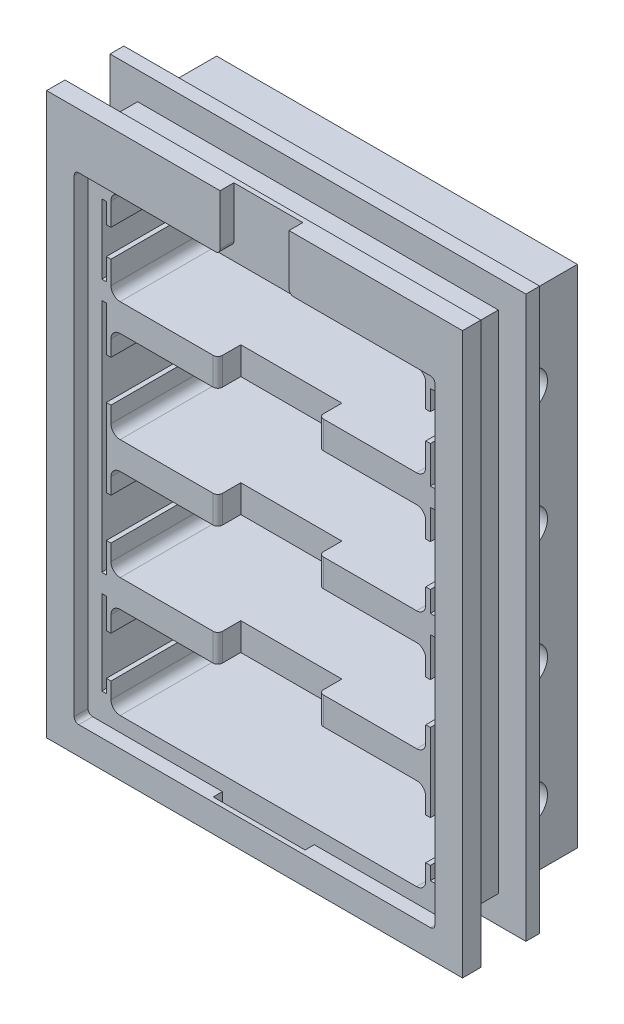
from build123d import *

# Parameters (mm, degrees)
SKETCH1_R                = 1.55
BOSS_EXTRUDE1_DEPTH      = 25
SKETCH2_W                = 78.500001967
SKETCH2_H                = 110
BOSS_EXTRUDE2_DEPTH      = 3
BOSS_EXTRUDE4_DEPTH      = 3
BOSS_EXTRUDE4_DEPTH_BACK = 1
SKETCH4_W                = 90.500001967
SKETCH4_H                = 122
SKETCH4_W_2              = 78.500001967
SKETCH4_H_2              = 110
SKETCH5_W                = 12
SKETCH5_H                = 3
SKETCH5_H_2              = 2
CUT_EXTRUDE1_DEPTH       = 4
SKETCH6_W                = 0.999998301
SKETCH6_H                = 11.230002105
SKETCH6_H_2              = 11.230002106
CUT_EXTRUDE2_DEPTH       = 25
CUT_EXTRUDE3_DEPTH       = 145.507259106
CUT_EXTRUDE3_DEPTH_BACK  = 145.507259106
SKETCH10_R               = 1.5
SKETCH14_R               = 4
CUT_EXTRUDE4_DEPTH       = 1.8
CUT_EXTRUDE5_START       = -1.8
SKETCH15_R               = 4
CUT_EXTRUDE5_DEPTH       = 1.8
SKETCH16_W               = 90.500001967
SKETCH16_H               = 122
SKETCH16_W_2             = 78.500001967
SKETCH16_H_2             = 110
BOSS_EXTRUDE5_DEPTH      = 3
SKETCH3_W                = 88.500001967
SKETCH3_H                = 120
SKETCH3_W_2              = 78.500001967
SKETCH3_H_2              = 104
BOSS_EXTRUDE3_DEPTH      = 3
SKETCH19_W               = 20
SKETCH19_H               = 2
CUT_EXTRUDE7_DEPTH       = 147.219869828
SKETCH20_W               = 22.901962545
SKETCH20_H               = 5.863970951
BOSS_EXTRUDE7_DEPTH      = 1
SKETCH21_W               = 15
SKETCH21_H               = 12
CUT_EXTRUDE8_DEPTH       = 3
FILLET1_R                = 1
SKETCH17_R               = 2
BOSS_EXTRUDE6_DEPTH      = 5
SKETCH18_W               = 116.372418442
SKETCH18_H               = 131.31127259
CUT_EXTRUDE6_DEPTH       = 2
SKETCH22_W               = 19
SKETCH22_H               = 1.8
BOSS_EXTRUDE8_DEPTH      = 4
FILLET2_R                = 0.5
SKETCH23_W               = 128.007557952
SKETCH23_H               = 137.306220181
CUT_EXTRUDE9_DEPTH       = 147.823875212
SKETCH24_R               = 3.048362671
BOSS_EXTRUDE9_DEPTH      = 4
SKETCH25_W               = 0.999998301
SKETCH25_H               = 4
SKETCH25_H_2             = 3.999998585
BOSS_EXTRUDE10_DEPTH     = 25
SKETCH26_W               = 2
SKETCH26_H               = 4
CUT_EXTRUDE10_DEPTH      = 10
SKETCH27_W               = 1.00120379
SKETCH27_H               = 1.5
CUT_EXTRUDE11_DEPTH      = 25
SKETCH28_W               = 22
SKETCH28_H               = 6
CUT_EXTRUDE12_DEPTH      = 5
FILLET3_R                = 1


with BuildPart() as part:
    # Sketch1 → Boss-Extrude1 (new body)
    with BuildSketch(Plane.XY):
        Polygon((39.250000983, 0), (78.500001967, 0), (78.500001967, 110), (0, 110), (0, 0), align=None)
        with Locations((39.250000983, 105.61)):
            Circle(SKETCH1_R, mode=Mode.SUBTRACT)
        with BuildLine():
            Line((2.999401145, 5.835748483), (3.999399446, 5.835748483))
            Line((3.999399446, 5.835748483), (3.999399446, 10.220747148))
            Line((3.999399446, 10.220747148), (5.000603236, 10.220747148))
            Line((5.000603236, 10.220747148), (5.000603236, 5.220747431))
            ThreePointArc((5.000603236, 5.220747431), (5.586389674, 3.806533868), (7.000603236, 3.220747431))
            Line((7.000603236, 3.220747431), (71.500600494, 3.220747431))
            ThreePointArc((71.500600494, 3.220747431), (72.914814057, 3.806533868), (73.500600494, 5.220747431))
            Line((73.500600494, 5.220747431), (73.500600494, 10.220747148))
            Line((73.500600494, 10.220747148), (74.501804284, 10.220747148))
            Line((74.501804284, 10.220747148), (74.501804284, 5.835748483))
            Line((74.501804284, 5.835748483), (75.501802585, 5.835748483))
            Line((75.501802585, 5.835748483), (75.501802585, 20.605747794))
            Line((75.501802585, 20.605747794), (74.501804284, 20.605747794))
            Line((74.501804284, 20.605747794), (74.501804284, 16.220747148))
            Line((74.501804284, 16.220747148), (73.500600494, 16.220747148))
            Line((73.500600494, 16.220747148), (73.500600494, 21.220748846))
            ThreePointArc((73.500600494, 21.220748846), (72.914814057, 22.634962409), (71.500600494, 23.220748846))
            Line((71.500600494, 23.220748846), (7.000603236, 23.220748846))
            ThreePointArc((7.000603236, 23.220748846), (5.586389674, 22.634962409), (5.000603236, 21.220748846))
            Line((5.000603236, 21.220748846), (5.000603236, 16.220747148))
            Line((5.000603236, 16.220747148), (3.999399446, 16.220747148))
            Line((3.999399446, 16.220747148), (3.999399446, 20.605747794))
            Line((3.999399446, 20.605747794), (2.999401145, 20.605747794))
            Line((2.999401145, 20.605747794), (2.999401145, 5.835748483))
        make_face(mode=Mode.SUBTRACT)
        with BuildLine():
            Line((7.000603236, 29.220747431), (71.500600494, 29.220747431))
            ThreePointArc((71.500600494, 29.220747431), (72.914814057, 29.806533868), (73.500600494, 31.220747431))
            Line((73.500600494, 31.220747431), (73.500600494, 36.220747148))
            Line((73.500600494, 36.220747148), (74.501804284, 36.220747148))
            Line((74.501804284, 36.220747148), (74.501804284, 31.835748483))
            Line((74.501804284, 31.835748483), (75.501802585, 31.835748483))
            Line((75.501802585, 31.835748483), (75.501802585, 46.605747794))
            Line((75.501802585, 46.605747794), (74.501804284, 46.605747794))
            Line((74.501804284, 46.605747794), (74.501804284, 42.220747148))
            Line((74.501804284, 42.220747148), (73.500600494, 42.220747148))
            Line((73.500600494, 42.220747148), (73.500600494, 47.220748846))
            ThreePointArc((73.500600494, 47.220748846), (72.914814057, 48.634962409), (71.500600494, 49.220748846))
            Line((71.500600494, 49.220748846), (7.000603236, 49.220748846))
            ThreePointArc((7.000603236, 49.220748846), (5.586389674, 48.634962409), (5.000603236, 47.220748846))
            Line((5.000603236, 47.220748846), (5.000603236, 42.220747148))
            Line((5.000603236, 42.220747148), (3.999399446, 42.220747148))
            Line((3.999399446, 42.220747148), (3.999399446, 46.605747794))
            Line((3.999399446, 46.605747794), (2.999401145, 46.605747794))
            Line((2.999401145, 46.605747794), (2.999401145, 31.835748483))
            Line((2.999401145, 31.835748483), (3.999399446, 31.835748483))
            Line((3.999399446, 31.835748483), (3.999399446, 36.220747148))
            Line((3.999399446, 36.220747148), (5.000603236, 36.220747148))
            Line((5.000603236, 36.220747148), (5.000603236, 31.220747431))
            ThreePointArc((5.000603236, 31.220747431), (5.586389674, 29.806533868), (7.000603236, 29.220747431))
        make_face(mode=Mode.SUBTRACT)
        with BuildLine():
            Line((73.500600494, 57.220748846), (73.500600494, 62.220748563))
            Line((73.500600494, 62.220748563), (74.501804284, 62.220748563))
            Line((74.501804284, 62.220748563), (74.501804284, 57.835749899))
            Line((74.501804284, 57.835749899), (75.501802585, 57.835749899))
            Line((75.501802585, 57.835749899), (75.501802585, 72.605749209))
            Line((75.501802585, 72.605749209), (74.501804284, 72.605749209))
            Line((74.501804284, 72.605749209), (74.501804284, 68.220748563))
            Line((74.501804284, 68.220748563), (73.500600494, 68.220748563))
            Line((73.500600494, 68.220748563), (73.500600494, 73.220750262))
            ThreePointArc((73.500600494, 73.220750262), (72.914814057, 74.634963824), (71.500600494, 75.220750262))
            Line((71.500600494, 75.220750262), (7.000603236, 75.220750262))
            ThreePointArc((7.000603236, 75.220750262), (5.586389674, 74.634963824), (5.000603236, 73.220750262))
            Line((5.000603236, 73.220750262), (5.000603236, 68.220748563))
            Line((5.000603236, 68.220748563), (3.999399446, 68.220748563))
            Line((3.999399446, 68.220748563), (3.999399446, 72.605749209))
            Line((3.999399446, 72.605749209), (2.999401145, 72.605749209))
            Line((2.999401145, 72.605749209), (2.999401145, 57.835749899))
            Line((2.999401145, 57.835749899), (3.999399446, 57.835749899))
            Line((3.999399446, 57.835749899), (3.999399446, 62.220748563))
            Line((3.999399446, 62.220748563), (5.000603236, 62.220748563))
            Line((5.000603236, 62.220748563), (5.000603236, 57.220748846))
            ThreePointArc((5.000603236, 57.220748846), (5.586389674, 55.806535284), (7.000603236, 55.220748846))
            Line((7.000603236, 55.220748846), (71.500600494, 55.220748846))
            ThreePointArc((71.500600494, 55.220748846), (72.914814057, 55.806535284), (73.500600494, 57.220748846))
        make_face(mode=Mode.SUBTRACT)
        with BuildLine():
            Line((73.500600494, 83.220750262), (73.500600494, 88.220749979))
            Line((73.500600494, 88.220749979), (74.501804284, 88.220749979))
            Line((74.501804284, 88.220749979), (74.501804284, 83.835751315))
            Line((74.501804284, 83.835751315), (75.501802585, 83.835751315))
            Line((75.501802585, 83.835751315), (75.501802585, 98.605750625))
            Line((75.501802585, 98.605750625), (74.501804284, 98.605750625))
            Line((74.501804284, 98.605750625), (74.501804284, 94.220749979))
            Line((74.501804284, 94.220749979), (73.500600494, 94.220749979))
            Line((73.500600494, 94.220749979), (73.500600494, 99.220751678))
            ThreePointArc((73.500600494, 99.220751678), (72.914814057, 100.63496524), (71.500600494, 101.220751678))
            Line((71.500600494, 101.220751678), (7.000603236, 101.220751678))
            ThreePointArc((7.000603236, 101.220751678), (5.586389674, 100.63496524), (5.000603236, 99.220751678))
            Line((5.000603236, 99.220751678), (5.000603236, 94.220749979))
            Line((5.000603236, 94.220749979), (3.999399446, 94.220749979))
            Line((3.999399446, 94.220749979), (3.999399446, 98.605750625))
            Line((3.999399446, 98.605750625), (2.999401145, 98.605750625))
            Line((2.999401145, 98.605750625), (2.999401145, 83.835751315))
            Line((2.999401145, 83.835751315), (3.999399446, 83.835751315))
            Line((3.999399446, 83.835751315), (3.999399446, 88.220749979))
            Line((3.999399446, 88.220749979), (5.000603236, 88.220749979))
            Line((5.000603236, 88.220749979), (5.000603236, 83.220750262))
            ThreePointArc((5.000603236, 83.220750262), (5.586389674, 81.8065367), (7.000603236, 81.220750262))
            Line((7.000603236, 81.220750262), (71.500600494, 81.220750262))
            ThreePointArc((71.500600494, 81.220750262), (72.914814057, 81.8065367), (73.500600494, 83.220750262))
        make_face(mode=Mode.SUBTRACT)
    extrude(amount=BOSS_EXTRUDE1_DEPTH)

    # Sketch2 → Boss-Extrude2 (add)
    with BuildSketch(Plane(origin=(0, 0, 0), x_dir=(-1, 0, 0), z_dir=(0, 0, -1))):
        with Locations((-39.250000984, 55)):
            Rectangle(SKETCH2_W, SKETCH2_H)
    extrude(amount=BOSS_EXTRUDE2_DEPTH)

    # Sketch6 → Cut-Extrude2 (cut)
    with BuildSketch(Plane.XY.offset(25)):
        with Locations((3.499400296, 52.220748847)):
            Rectangle(SKETCH6_W, SKETCH6_H)
        with Locations((3.499400296, 78.220750262)):
            Rectangle(SKETCH6_W, SKETCH6_H_2)
        with Locations((3.499400296, 26.220747431)):
            Rectangle(SKETCH6_W, SKETCH6_H)
        with Locations((75.001803435, 78.220750262)):
            Rectangle(SKETCH6_W, SKETCH6_H_2)
        with Locations((75.001803435, 52.220748847)):
            Rectangle(SKETCH6_W, SKETCH6_H)
        with Locations((75.001803435, 26.220747431)):
            Rectangle(SKETCH6_W, SKETCH6_H)
    extrude(amount=-CUT_EXTRUDE2_DEPTH, mode=Mode.SUBTRACT)

    # Sketch10 → Cut-Extrude3 (cut, two sides: drawn at the far end of the back side and taken through both)
    with BuildSketch(Plane(origin=(2.999401145, 0, 0), x_dir=(0, 0, -1), z_dir=(1, 0, 0)).offset(-CUT_EXTRUDE3_DEPTH_BACK)):
        with Locations(Location((-7.5, 91.340117732, 0), (0, 0, 180))):
            Circle(SKETCH10_R)
        with Locations(Location((-7.5, 65.340117732, 0), (0, 0, 180))):
            Circle(SKETCH10_R)
        with Locations(Location((-7.5, 39.340117732, 0), (0, 0, 180))):
            Circle(SKETCH10_R)
        with Locations(Location((-7.5, 13.340117732, 0), (0, 0, 180))):
            Circle(SKETCH10_R)
    extrude(amount=CUT_EXTRUDE3_DEPTH + CUT_EXTRUDE3_DEPTH_BACK, mode=Mode.SUBTRACT)

    # Sketch14 → Cut-Extrude4 (cut)
    with BuildSketch(Plane.ZY):
        with Locations((7.5, 91.340117732)):
            Circle(SKETCH14_R)
        with Locations((7.5, 65.340117732)):
            Circle(SKETCH14_R)
        with Locations((7.5, 39.340117732)):
            Circle(SKETCH14_R)
        with Locations((7.5, 13.340117732)):
            Circle(SKETCH14_R)
    extrude(amount=-CUT_EXTRUDE4_DEPTH, mode=Mode.SUBTRACT)

    # Sketch15 → Cut-Extrude5 (cut)
    with BuildSketch(Plane(origin=(78.500001967, 0, 0), x_dir=(0, 0, -1), z_dir=(1, 0, 0)).offset(CUT_EXTRUDE5_START)):
        with Locations(Location((-7.5, 91.340117732, 0), (0, 0, 180))):
            Circle(SKETCH15_R)
        with Locations(Location((-7.5, 65.340117732, 0), (0, 0, 180))):
            Circle(SKETCH15_R)
        with Locations(Location((-7.5, 39.340117732, 0), (0, 0, 180))):
            Circle(SKETCH15_R)
        with Locations(Location((-7.5, 13.340117732, 0), (0, 0, 180))):
            Circle(SKETCH15_R)
    extrude(amount=CUT_EXTRUDE5_DEPTH, mode=Mode.SUBTRACT)

    # Sketch16 → Boss-Extrude5 (add)
    with BuildSketch(Plane(origin=(0, 0, 14.2), x_dir=(-1, 0, 0), z_dir=(0, 0, -1))):
        with Locations((-39.250000984, 55)):
            Rectangle(SKETCH16_W, SKETCH16_H)
        with Locations((-39.250000984, 55)):
            Rectangle(SKETCH16_W_2, SKETCH16_H_2, mode=Mode.SUBTRACT)
    extrude(amount=BOSS_EXTRUDE5_DEPTH)



with BuildPart() as body_2:
    # Sketch4 → Boss-Extrude4 (new, two sides: drawn at the far end of the back side and taken through both)
    with BuildSketch(Plane.XY.offset(25).offset(-BOSS_EXTRUDE4_DEPTH_BACK)):
        with Locations((39.250000984, 55)):
            Rectangle(SKETCH4_W, SKETCH4_H)
        with Locations((39.250000984, 55)):
            Rectangle(SKETCH4_W_2, SKETCH4_H_2, mode=Mode.SUBTRACT)
    extrude(amount=BOSS_EXTRUDE4_DEPTH + BOSS_EXTRUDE4_DEPTH_BACK)

    # Sketch5 → Cut-Extrude1 (cut)
    with BuildSketch(Plane(origin=(0, 0, 0), x_dir=(1, 0, 0), z_dir=(0, 1, 0))):
        with Locations((24.17, -23.5)):
            Rectangle(SKETCH5_W, SKETCH5_H)
        with Locations((54.336666667, -26)):
            Rectangle(SKETCH5_W, SKETCH5_H_2)
    extrude(amount=-CUT_EXTRUDE1_DEPTH, mode=Mode.SUBTRACT)

    # Sketch3 → Boss-Extrude3 (add)
    with BuildSketch(Plane.XY.offset(25)):
        with Locations((39.250000984, 55)):
            Rectangle(SKETCH3_W, SKETCH3_H)
        with Locations((39.250000984, 52)):
            Rectangle(SKETCH3_W_2, SKETCH3_H_2, mode=Mode.SUBTRACT)
    extrude(amount=BOSS_EXTRUDE3_DEPTH)

    # Sketch19 → Cut-Extrude7 (cut, through all)
    with BuildSketch(Plane(origin=(0, 0, 0), x_dir=(1, 0, 0), z_dir=(0, 1, 0))):
        with Locations((39.250001967, -26)):
            Rectangle(SKETCH19_W, SKETCH19_H)
    extrude(amount=-CUT_EXTRUDE7_DEPTH, mode=Mode.SUBTRACT)


with BuildPart() as part_1:
    add(part.part)

    add(body_2.part)  # Boss-Extrude7 merges body 2
    # Sketch20 → Boss-Extrude7 (add)
    with BuildSketch(Plane(origin=(0, 0, 24), x_dir=(-1, 0, 0), z_dir=(0, 0, -1))):
        with Locations((-19.90671124, -2.931985476)):
            Rectangle(SKETCH20_W, SKETCH20_H)
    extrude(amount=-BOSS_EXTRUDE7_DEPTH)

    # Sketch21 → Cut-Extrude8 (cut)
    with BuildSketch(Plane.XY.offset(28)):
        with Locations((39.25, 110)):
            Rectangle(SKETCH21_W, SKETCH21_H)
    extrude(amount=-CUT_EXTRUDE8_DEPTH, mode=Mode.SUBTRACT)

    # Fillet1
    fillet1_edges = [part_1.edges().sort_by_distance(p)[0] for p in [
        (78.500001967, 0, 26.5),
        (78.500001967, 104, 26.5),
        (0, 0, 26.5),
        (0, 104, 26.5),
        (31.75, 104, 26.5),
        (46.75, 104, 26.5),
    ]]
    fillet(fillet1_edges, radius=FILLET1_R)

    # Sketch24 → Boss-Extrude9 (add)
    with BuildSketch(Plane.XY.offset(25)):
        with Locations((39.250000983, 105.61)):
            Circle(SKETCH24_R)
    extrude(amount=-BOSS_EXTRUDE9_DEPTH)

    # Sketch25 → Boss-Extrude10 (add)
    with BuildSketch(Plane.XY.offset(25)):
        with Locations((75.001803435, 54.220747855)):
            Rectangle(SKETCH25_W, SKETCH25_H)
        with Locations((3.499400296, 26.220748139)):
            Rectangle(SKETCH25_W, SKETCH25_H_2)
        with Locations((3.499400296, 81.458051484)):
            Rectangle(SKETCH25_W, SKETCH25_H)
        with Locations((75.001803435, 78.220750262)):
            Rectangle(SKETCH25_W, SKETCH25_H)
    extrude(amount=-BOSS_EXTRUDE10_DEPTH)

    # Sketch26 → Cut-Extrude10 (cut)
    with BuildSketch(Plane.XY):
        with Locations((3.999401145, 13.340747148)):
            Rectangle(SKETCH26_W, SKETCH26_H)
        with Locations((74.501802585, 65.340748563)):
            Rectangle(SKETCH26_W, SKETCH26_H)
    extrude(amount=-CUT_EXTRUDE10_DEPTH, mode=Mode.SUBTRACT)

    # Sketch27 → Cut-Extrude11 (cut)
    with BuildSketch(Plane.XY.offset(25)):
        with Locations((4.500001341, 9.470747148)):
            Rectangle(SKETCH27_W, SKETCH27_H)
        with Locations((74.001202389, 9.470747148)):
            Rectangle(SKETCH27_W, SKETCH27_H)
        with Locations((74.001202389, 35.470747148)):
            Rectangle(SKETCH27_W, SKETCH27_H)
        with Locations((4.500001341, 35.470747148)):
            Rectangle(SKETCH27_W, SKETCH27_H)
        with Locations((4.500001341, 61.470748563)):
            Rectangle(SKETCH27_W, SKETCH27_H)
        with Locations((74.001202389, 61.470748563)):
            Rectangle(SKETCH27_W, SKETCH27_H)
        with Locations((4.500001341, 16.970747148)):
            Rectangle(SKETCH27_W, SKETCH27_H)
        with Locations((74.001202389, 16.970747148)):
            Rectangle(SKETCH27_W, SKETCH27_H)
        with Locations((4.500001341, 42.970747148)):
            Rectangle(SKETCH27_W, SKETCH27_H)
        with Locations((74.001202389, 42.970747148)):
            Rectangle(SKETCH27_W, SKETCH27_H)
        with Locations((4.500001341, 68.970748563)):
            Rectangle(SKETCH27_W, SKETCH27_H)
        with Locations((74.001202389, 68.970748563)):
            Rectangle(SKETCH27_W, SKETCH27_H)
    extrude(amount=-CUT_EXTRUDE11_DEPTH, mode=Mode.SUBTRACT)

    # Sketch28 → Cut-Extrude12 (cut)
    with BuildSketch(Plane.XY.offset(25)):
        with Locations((39.250601865, 78.220750262)):
            Rectangle(SKETCH28_W, SKETCH28_H)
        with Locations((39.250601865, 52.220748846)):
            Rectangle(SKETCH28_W, SKETCH28_H)
        with Locations((39.250601865, 26.220747431)):
            Rectangle(SKETCH28_W, SKETCH28_H)
    extrude(amount=-CUT_EXTRUDE12_DEPTH, mode=Mode.SUBTRACT)

    # Fillet3
    fillet3_edges = [part_1.edges().sort_by_distance(p)[0] for p in [
        (28.250601865, 78.220750262, 25),
        (50.250601865, 78.220750262, 25),
        (28.250601865, 52.220748846, 25),
        (50.250601865, 52.220748846, 25),
        (28.250601865, 26.220748139, 25),
        (50.250601865, 26.220748139, 25),
    ]]
    fillet(fillet3_edges, radius=FILLET3_R)


with BuildPart() as body_2_2:
    # Sketch17 → Boss-Extrude6 (new body)
    with BuildSketch(Plane.XY.offset(28)):
        with BuildLine():
            Line((1.3, 103.7), (31.05, 103.7))
            ThreePointArc((31.05, 103.7), (31.757106781, 103.992893219), (32.05, 104.7))
            Line((32.05, 104.7), (32.05, 115.7))
            Line((32.05, 115.7), (32.05, 116))
            Line((32.05, 116), (46.45, 116))
            Line((46.45, 116), (46.45, 115.7))
            Line((46.45, 115.7), (46.45, 104.7))
            ThreePointArc((46.45, 104.7), (46.742893219, 103.992893219), (47.45, 103.7))
            Line((47.45, 103.7), (77.200001967, 103.7))
            ThreePointArc((77.200001967, 103.7), (77.907108748, 103.407106781), (78.200001967, 102.7))
            Line((78.200001967, 102.7), (78.200001967, 1.3))
            ThreePointArc((78.200001967, 1.3), (77.907108748, 0.592893219), (77.200001967, 0.3))
            Line((77.200001967, 0.3), (1.3, 0.3))
            ThreePointArc((1.3, 0.3), (0.592893219, 0.592893219), (0.3, 1.3))
            Line((0.3, 1.3), (0.3, 102.7))
            ThreePointArc((0.3, 102.7), (0.592893219, 103.407106781), (1.3, 103.7))
        make_face()
        with Locations((39.25, 110)):
            Circle(SKETCH17_R, mode=Mode.SUBTRACT)
    extrude(amount=BOSS_EXTRUDE6_DEPTH)

    # Sketch18 → Cut-Extrude6 (cut)
    with BuildSketch(Plane.XY.offset(28)):
        with Locations((39.563842457, 55.779872865)):
            Rectangle(SKETCH18_W, SKETCH18_H)
    extrude(amount=CUT_EXTRUDE6_DEPTH, mode=Mode.SUBTRACT)

    # Sketch22 → Boss-Extrude8 (add)
    with BuildSketch(Plane.XZ.offset(-0.3)):
        with Locations((39.25, 30.9)):
            Rectangle(SKETCH22_W, SKETCH22_H)
    extrude(amount=BOSS_EXTRUDE8_DEPTH)

    # Fillet2
    fillet2_edges = [body_2_2.edges().sort_by_distance(p)[0] for p in [
        (29.75, -3.7, 30.9),
        (48.75, -3.7, 30.9),
    ]]
    fillet(fillet2_edges, radius=FILLET2_R)

    # Sketch23 → Cut-Extrude9 (cut, through all)
    with BuildSketch(Plane.XY.offset(28)):
        with Locations((44.973599692, 54.698095383)):
            Rectangle(SKETCH23_W, SKETCH23_H)
    extrude(amount=CUT_EXTRUDE9_DEPTH, mode=Mode.SUBTRACT)


solid = part_1.part
